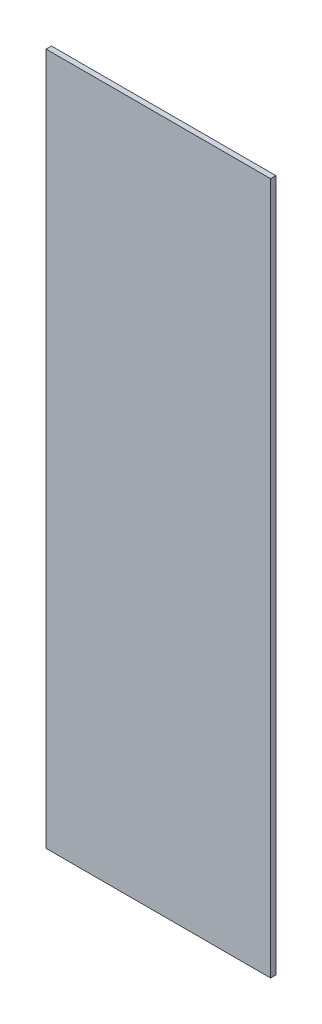
from build123d import *

# Parameters (mm, degrees)
SKETCH1_W           = 535.000000102
SKETCH1_H           = 1650
BOSS_EXTRUDE1_DEPTH = 12.7


with BuildPart() as part:
    # Sketch1 → Boss-Extrude1 (new body)
    with BuildSketch(Plane.XY):
        Rectangle(SKETCH1_W, SKETCH1_H)
    extrude(amount=BOSS_EXTRUDE1_DEPTH)


solid = part.part
